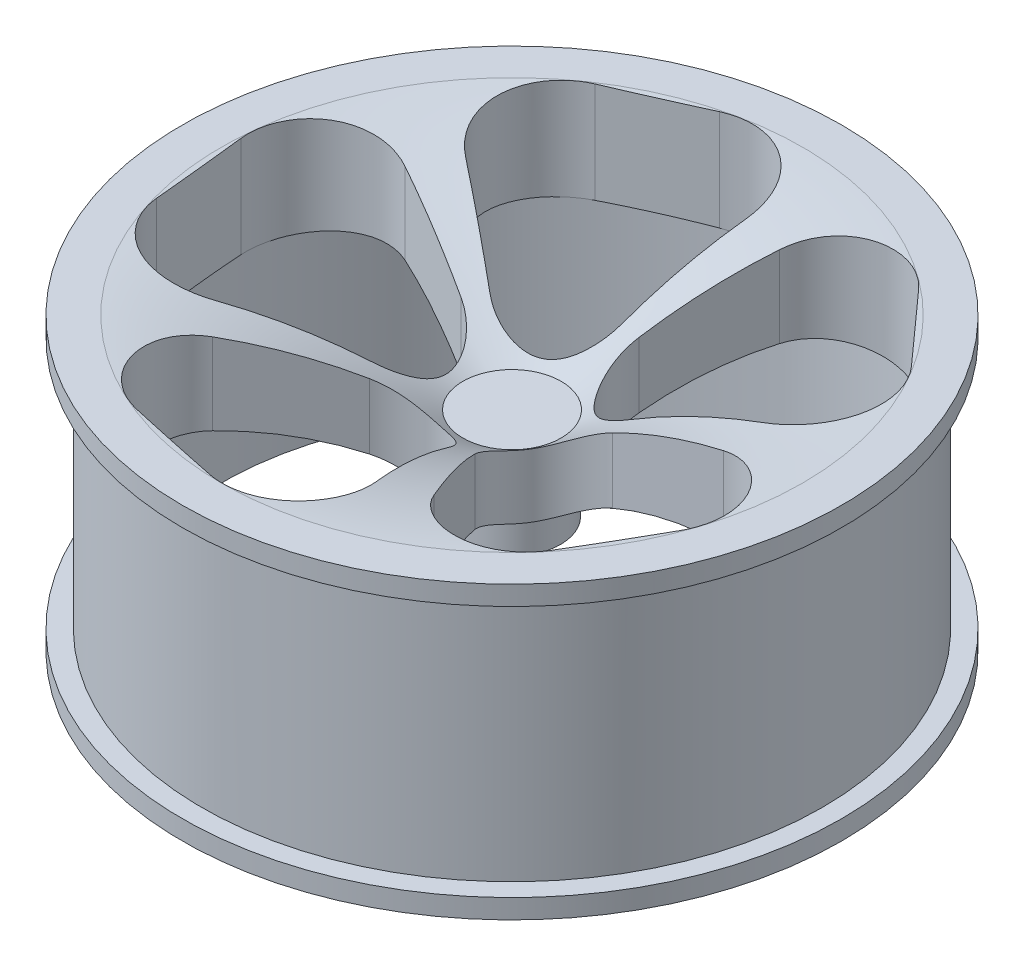
from build123d import *

# Parameters (mm, degrees)
SKETCH1_R           = 50
BOSS_EXTRUDE1_DEPTH = 30
SKETCH3_R           = 340
BOSS_EXTRUDE2_DEPTH = 150
SKETCH5_W           = 20
SKETCH5_H           = 130


with BuildPart() as part:
    # Sketch1 → Boss-Extrude1 (new body)
    with BuildSketch(Plane(origin=(0, 0, 0), x_dir=(1, 0, 0), z_dir=(0, 1, 0))):
        with Locations(Location((0, 0, 0), (0, 0, 270))):
            Circle(SKETCH1_R)
    extrude(amount=BOSS_EXTRUDE1_DEPTH)



with BuildPart() as body_2:
    # Sketch2 → Revolve1 (revolve)
    with BuildSketch(Plane.XY, mode=Mode.PRIVATE) as revolve1_sk:
        Polygon((-320, 160), (-340, 160), (-340, 180), (-300, 180), (-300, -120), (-340, -120), (-340, -100), (-320, -100), align=None)
    revolve(revolve1_sk.sketch.rotate(Axis((0, -1000, 0), (0, 1, 0)), 180), axis=Axis((0, -1000, 0), (0, 1, 0)))


with BuildPart() as part_1:
    add(part.part)

    add(body_2.part)  # Boss-Extrude2 merges body 2
    # Sketch3 → Boss-Extrude2 (add, through all)
    with BuildSketch(Plane(origin=(0, 30, 0), x_dir=(1, 0, 0), z_dir=(0, 1, 0))):
        with Locations(Location((0, 0, 0), (0, 0, 270))):
            Circle(SKETCH3_R)
        with BuildLine():
            Line((101.68985136, 21.428348754), (214.055597401, 45.106349674))
            ThreePointArc((214.055597401, 45.106349674), (266.157873991, 91.854106563), (251.72426725, 160.34988013))
            Line((251.72426725, 160.34988013), (186.602713931, 232.930500221))
            ThreePointArc((186.602713931, 232.930500221), (120.066830601, 254.678516898), (67.964554011, 207.930760009))
            Line((67.964554011, 207.930760009), (32.287431298, 98.780168962))
            ThreePointArc((32.287431298, 98.780168962), (44.65909422, 40.069505905), (101.68985136, 21.428348754))
        make_face(mode=Mode.SUBTRACT)
        with BuildLine():
            Line((218.756106449, -0.383993473), (103.922888348, -0.182421014))
            ThreePointArc((103.922888348, -0.182421014), (51.908783763, -30.091164289), (51.803462941, -90.091071851))
            Line((51.803462941, -90.091071851), (109.045505122, -189.640342154))
            ThreePointArc((109.045505122, -189.640342154), (169.605752845, -224.746700491), (230.288874861, -189.853166671))
            Line((230.288874861, -189.853166671), (279.193479881, -105.490243966))
            ThreePointArc((279.193479881, -105.490243966), (279.316354173, -35.49035181), (218.756106449, -0.383993473))
        make_face(mode=Mode.SUBTRACT)
        with BuildLine():
            Line((67.234155021, -208.168081027), (31.94044591, -98.892911349))
            ThreePointArc((31.94044591, -98.892911349), (-12.577701539, -58.666868197), (-69.673550528, -77.10769324))
            Line((-69.673550528, -77.10769324), (-146.661768916, -162.310526764))
            ThreePointArc((-146.661768916, -162.310526764), (-161.335754045, -230.755206326), (-109.397915354, -277.685590004))
            Line((-109.397915354, -277.685590004), (-14.051653928, -298.127056474))
            ThreePointArc((-14.051653928, -298.127056474), (52.560169892, -276.612760589), (67.234155021, -208.168081027))
        make_face(mode=Mode.SUBTRACT)
        with BuildLine():
            Line((-177.203113441, -128.270955974), (-84.18260716, -60.936759446))
            ThreePointArc((-84.18260716, -60.936759446), (-59.682230815, -6.16695427), (-94.864085284, 42.435896634))
            Line((-94.864085284, 42.435896634), (-199.687463162, 89.326919883))
            ThreePointArc((-199.687463162, 89.326919883), (-269.316732446, 82.1321399), (-297.900504848, 18.234033863))
            Line((-297.900504848, 18.234033863), (-287.877879606, -78.762409901))
            ThreePointArc((-287.877879606, -78.762409901), (-246.832382725, -135.465735956), (-177.203113441, -128.270955974))
        make_face(mode=Mode.SUBTRACT)
        with BuildLine():
            Line((-176.75170204, 128.892270465), (-83.968158396, 61.231922847))
            ThreePointArc((-83.968158396, 61.231922847), (-24.307945629, 54.85548085), (11.04432151, 103.334519704))
            Line((11.04432151, 103.334519704), (23.248129554, 217.517599361))
            ThreePointArc((23.248129554, 217.517599361), (-5.111140346, 281.515660353), (-74.714721908, 288.954842683))
            Line((-74.714721908, 288.954842683), (-163.866660278, 249.449210119))
            ThreePointArc((-163.866660278, 249.449210119), (-205.11097194, 192.890331457), (-176.75170204, 128.892270465))
        make_face(mode=Mode.SUBTRACT)
    extrude(amount=BOSS_EXTRUDE2_DEPTH)

    # Sketch4 → Cut-Revolve1 (revolve, cut)
    with BuildSketch(Plane.XY, mode=Mode.PRIVATE) as cut_revolve1_sk:
        with BuildLine():
            ThreePointArc((-50.699515095, 30), (-170.44776913, 79.606291773), (-300, 75.526095188))
            Line((-300, 75.526095188), (-300, 50.693679631))
            Line((-300, 50.693679631), (-300, 30))
            Line((-300, 30), (-50.699515095, 30))
        make_face()
        with BuildLine():
            Line((0, 193.824444975), (-300, 190.11320815))
            Line((-300, 190.11320815), (-300, 180))
            ThreePointArc((-300, 180), (-169.65677438, 154.566972394), (-50.699515095, 95.529985497))
            Line((-50.699515095, 95.529985497), (0, 95.529985497))
            Line((0, 95.529985497), (0, 193.824444975))
        make_face()
    revolve(cut_revolve1_sk.sketch.rotate(Axis((0, -1000, 0), (0, 1, 0)), 180), axis=Axis((0, -1000, 0), (0, 1, 0)), mode=Mode.SUBTRACT)

    # Sketch5 → Cut-Revolve2 (revolve, cut)
    with BuildSketch(Plane(origin=(0, 0, 0), x_dir=(0, 0, -1), z_dir=(1, 0, 0)), mode=Mode.PRIVATE) as cut_revolve2_sk:
        with Locations((-330, 95)):
            Rectangle(SKETCH5_W, SKETCH5_H)
    revolve(cut_revolve2_sk.sketch.rotate(Axis((0, -1000, 0), (0, 1, 0)), 90), axis=Axis((0, -1000, 0), (0, 1, 0)), mode=Mode.SUBTRACT)


with BuildPart() as cut_revolve2_kept_piece:
    # of the separate pieces the step leaves, the one the design keeps (cut_revolve2_pieces_kept)
    add(part_1.part.solids().sort_by_distance((340, 180, 0))[0])


solid = cut_revolve2_kept_piece.part
